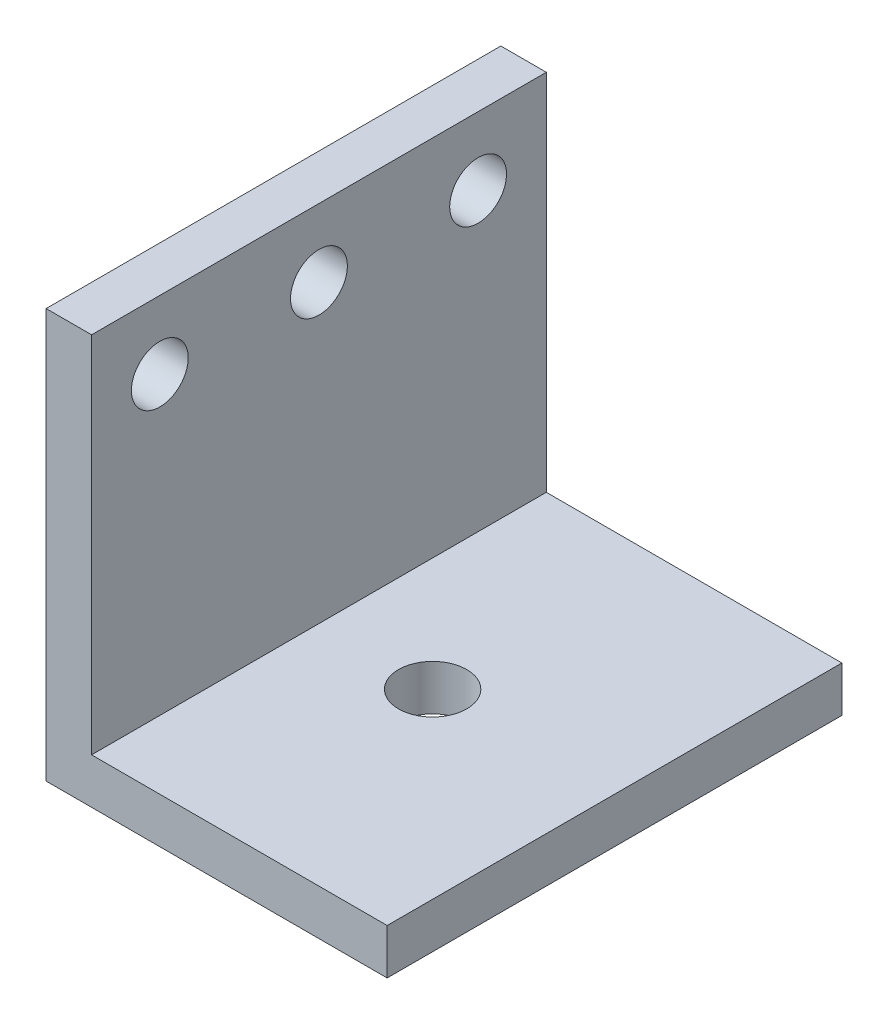
from build123d import *

# Parameters (mm, degrees)
EXTRUIR_L_MINA1_DEPTH = 100
CROQUIS2_R            = 6.25
CORTAR_EXTRUIR1_DEPTH = 10
CROQUIS3_R            = 7.5
CORTAR_EXTRUIR2_DEPTH = 10


with BuildPart() as part:
    # Croquis1 → Extruir-Lámina1 (new body)
    with BuildSketch(Plane.XY):
        Polygon((0, 90), (0, 0), (75, 0), (75, 10), (10, 10), (10, 90), align=None)
    extrude(amount=EXTRUIR_L_MINA1_DEPTH)

    # Croquis2 → Cortar-Extruir1 (cut)
    with BuildSketch(Plane.ZY):
        with Locations((15, 75)):
            Circle(CROQUIS2_R)
        with Locations((50, 75)):
            Circle(CROQUIS2_R)
        with Locations((85, 75)):
            Circle(CROQUIS2_R)
    extrude(amount=-CORTAR_EXTRUIR1_DEPTH, mode=Mode.SUBTRACT)

    # Croquis3 → Cortar-Extruir2 (cut)
    with BuildSketch(Plane(origin=(0, 10, 0), x_dir=(1, 0, 0), z_dir=(0, 1, 0))):
        with Locations(Location((35, -50, 0), (0, 0, 270))):
            Circle(CROQUIS3_R)
    extrude(amount=-CORTAR_EXTRUIR2_DEPTH, mode=Mode.SUBTRACT)


solid = part.part
